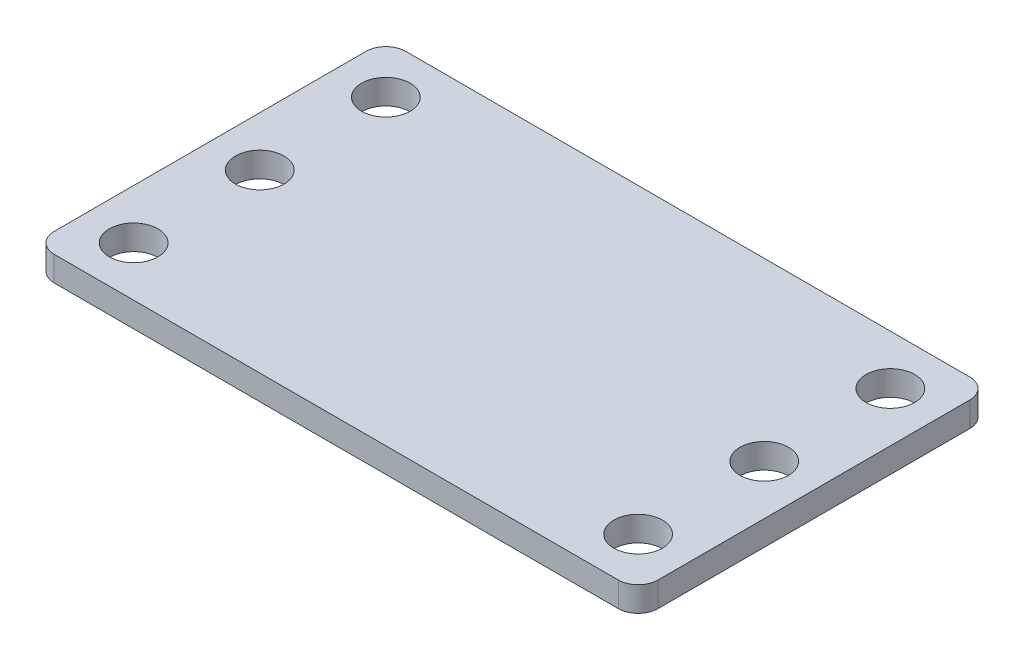
from build123d import *

# Parameters (mm, degrees)
CROQUIS1_W              = 60.8
CROQUIS1_H              = 35.4
CROQUIS1_R              = 2.45
SALIENTE_EXTRUIR1_DEPTH = 2.5
REDONDEO1_R             = 2


with BuildPart() as part:
    # Croquis1 → Saliente-Extruir1 (new body)
    with BuildSketch(Plane(origin=(0, 0, 0), x_dir=(1, 0, 0), z_dir=(0, 1, 0))):
        Rectangle(CROQUIS1_W, CROQUIS1_H)
        with Locations(Location((-25.4, 12.7, 0), (0, 0, 270))):
            Circle(CROQUIS1_R, mode=Mode.SUBTRACT)
        with Locations(Location((-25.4, 0, 0), (0, 0, 270))):
            Circle(CROQUIS1_R, mode=Mode.SUBTRACT)
        with Locations(Location((-25.4, -12.7, 0), (0, 0, 270))):
            Circle(CROQUIS1_R, mode=Mode.SUBTRACT)
        with Locations(Location((25.4, -12.7, 0), (0, 0, 90))):
            Circle(CROQUIS1_R, mode=Mode.SUBTRACT)
        with Locations(Location((25.4, 0, 0), (0, 0, 90))):
            Circle(CROQUIS1_R, mode=Mode.SUBTRACT)
        with Locations(Location((25.4, 12.7, 0), (0, 0, 90))):
            Circle(CROQUIS1_R, mode=Mode.SUBTRACT)
    extrude(amount=SALIENTE_EXTRUIR1_DEPTH)

    # Redondeo1
    redondeo1_edges = [part.edges().sort_by_distance(p)[0] for p in [
        (30.4, 1.25, 17.7),
        (-30.4, 1.25, 17.7),
        (-30.4, 1.25, -17.7),
        (30.4, 1.25, -17.7),
    ]]
    fillet(redondeo1_edges, radius=REDONDEO1_R)


solid = part.part
